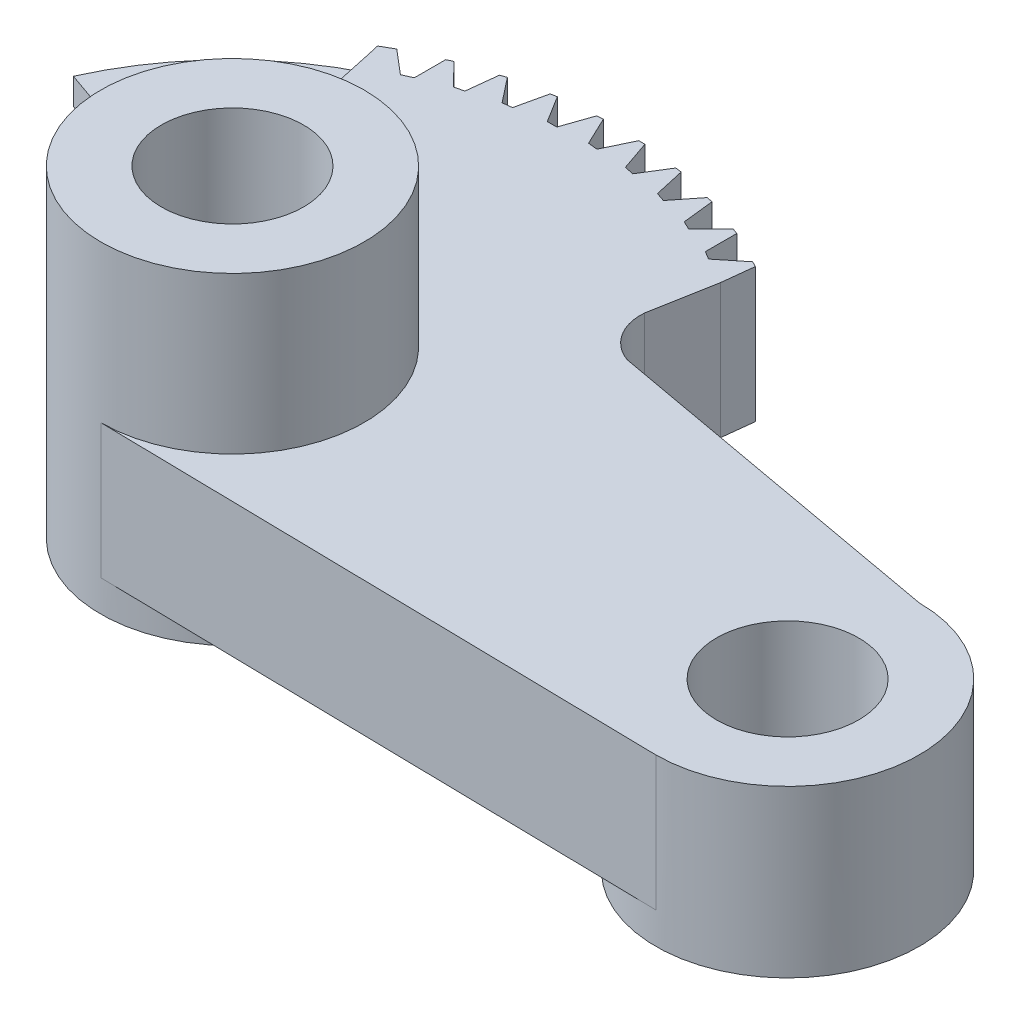
from build123d import *

# Parameters (mm, degrees)
SKETCH_1_R          = 2.7000000000000006
SKETCH_1_R_2        = 2.700000000000003
EXTRUDE_1_DEPTH     = 5.1
SKETCH_2_R          = 4.999999999999998
SKETCH_2_R_2        = 2.5
EXTRUDE_2_DEPTH     = 5.94
CUT_EXTRUDE_1_DEPTH = 3.5
CUT_EXTRUDE_START   = -0.6
CUT_EXTRUDE_3_DEPTH = 0.6
EXTRUDE_START       = 1.2
SKETCH_6_R          = 4.999999999999998
SKETCH_6_R_2        = 2.5
SKETCH_6_R_3        = 5
SKETCH_6_R_4        = 2.4999999999999987
EXTRUDE_4_DEPTH     = 1.2
SKETCH_7_R          = 2.6000000000000005
CUT_EXTRUDE_4_DEPTH = 33.57721194023454
SKETCH_8_R          = 2.6
CUT_EXTRUDE_5_DEPTH = 31.8406734329677
SKETCH_10_R         = 2.7
CUT_EXTRUDE_6_DEPTH = 33.57721194023454
SKETCH_11_R         = 2.700000000000001
CUT_EXTRUDE_7_DEPTH = 31.8406734329677


with BuildPart() as part:
    # Эскиз1 → Бобышка-Вытянуть1 (new body)
    with BuildSketch(Plane(origin=(0, 0, 0), x_dir=(1, 0, 0), z_dir=(0, 1, 0))):
        with BuildLine():
            Line((6.718023264525762, 8.928267668376021), (7.161238337218641, 11.37785065819786))
            Line((7.161238337218641, 11.37785065819786), (7.294846288705666, 12.560700282216452))
            Line((7.294846288705666, 12.560700282216452), (7.085001061393901, 12.665407082864023))
            Line((7.085001061393901, 12.665407082864023), (6.15987792536569, 11.916319971156167))
            Line((6.15987792536569, 11.916319971156167), (5.853623131200735, 12.10383694173367))
            Line((5.853623131200735, 12.10383694173367), (5.855060736117009, 13.29420757772634))
            Line((5.855060736117009, 13.29420757772634), (5.634886528714601, 13.37496556136943))
            Line((5.634886528714601, 13.37496556136943), (4.798663389284832, 12.527784837542624))
            Line((4.798663389284832, 12.527784837542624), (4.473480547373511, 12.680135526842204))
            Line((4.473480547373511, 12.680135526842204), (4.342730025112913, 13.863304415323501))
            Line((4.342730025112913, 13.863304415323501), (4.114949999467502, 13.919114749889351))
            Line((4.114949999467502, 13.919114749889351), (3.3779694438823102, 12.984318526945106))
            Line((3.3779694438823102, 12.984318526945106), (3.0378804853992434, 13.099618628946285))
            Line((3.0378804853992434, 13.099618628946285), (2.776558986480811, 14.260952083189514))
            Line((2.776558986480811, 14.260952083189514), (2.54399037483231, 14.291124494483034))
            Line((2.54399037483231, 14.291124494483034), (1.9153675367628848, 13.280274532718662))
            Line((1.9153675367628848, 13.280274532718662), (1.56457875493138, 13.35709799101592))
            Line((1.56457875493138, 13.35709799101592), (1.175918359734634, 14.482232389631033))
            Line((1.175918359734634, 14.482232389631033), (0.9414376205823001, 14.486393698794194))
            Line((0.9414376205823001, 14.486393698794194), (0.4289474421954887, 13.411992407470256))
            Line((0.42894744219548875, 13.411992407470256), (0.07179746795026506, 13.449389053044667))
            Line((0.07179746795026506, 13.449389053044667), (-0.4393947883485354, 14.524408492330128))
            Line((-0.43939478834853546, 14.524408492330128), (-0.6728875469021285, 14.502507231398162))
            Line((-0.6728875469021285, 14.502507231398162), (-1.062906477097084, 13.377843036257644))
            Line((-1.062906477097084, 13.377843036257644), (-1.4220003362283888, 13.375350339371238))
            Line((-1.4220003362283888, 13.375350339371238), (-2.049401918098927, 14.386958748197415))
            Line((-2.049401918098927, 14.386958748197415), (-2.279018807507275, 14.33926579666565))
            Line((-2.279018807507275, 14.33926579666565), (-2.5417426516817105, 13.178248785832608))
            Line((-2.5417426516817105, 13.178248785832608), (-2.898339045786024, 13.13589757669542))
            Line((-2.898339045786024, 13.13589757669542), (-3.6341901158202092, 14.071583165165732))
            Line((-3.6341901158202092, 14.071583165165732), (-3.8570911851181764, 13.998688399693854))
            Line((-3.8570911851181764, 13.998688399693854), (-3.989270518385492, 12.815678280718325))
            Line((-3.989270518385492, 12.815678280718325), (-4.3389589867331635, 12.733992368173748))
            Line((-4.3389589867331635, 12.733992368173748), (-5.174158380979493, 13.582182376127184))
            Line((-5.174158380979493, 13.582182376127184), (-5.3875867419063175, 13.48498737481814))
            Line((-5.3875867419063175, 13.48498737481814), (-5.3875867419063175, 12.2946158707315))
            Line((-5.3875867419063175, 12.2946158707315), (-5.751610974482103, 12.12883970299033))
            Line((-5.751610974482103, 12.12883970299033), (-6.666748566138722, 12.905854249247858))
            Line((-6.666748566138722, 12.905854249247858), (-7.13096440438616, 12.63943472468846))
            Line((-7.13096440438616, 12.63943472468846), (-7.025830916712447, 12.175864106991055))
            ThreePointArc((-7.025830916712449, 12.175864106991055), (-10.264322646127633, 9.799709596012173), (-12.51111253150909, 6.470163958468902))
            Line((-12.51111253150909, 6.470163958468902), (-5.241071220187256, 3.924995297345621))
            Line((-5.241071220187256, 3.924995297345621), (-4.737733567637334, 1.5980865565051285))
            ThreePointArc((-4.737733567637334, 1.5980865565051288), (-4.061430338102922, -2.9162962141622684), (1.55e-15, -5))
            Line((2.2e-16, -5), (21.46693589645179, -5.388260461869603))
            ThreePointArc((21.46693589645179, -5.388260461869605), (26.46693589645179, -0.3882604618696045), (21.46693589645179, 4.611739538130397))
            Line((21.46693589645179, 4.611739538130397), (7.924308406385933, 7.062073595968816))
            ThreePointArc((7.924308406385932, 7.062073595968816), (7.00463576208043, 7.790569444059032), (6.718023264525762, 8.928267668376021))
        make_face()
        with Locations(Location((21.46693589645179, -0.3882604618696027, 0), (0, 0, 270))):
            Circle(SKETCH_1_R, mode=Mode.SUBTRACT)
        with Locations(Location((-2.22e-15, -1.39e-15, 0), (0, 0, 270))):
            Circle(SKETCH_1_R_2, mode=Mode.SUBTRACT)
    extrude(amount=EXTRUDE_1_DEPTH)

    # Эскиз2 → Бобышка-Вытянуть2 (add)
    with BuildSketch(Plane(origin=(0, 5.1, 0), x_dir=(1, 0, 0), z_dir=(0, 1, 0))):
        with Locations(Location((0, 0, 0), (0, 0, 270))):
            Circle(SKETCH_2_R)
        with Locations(Location((0, 0, 0), (0, 0, 270))):
            Circle(SKETCH_2_R_2, mode=Mode.SUBTRACT)
    extrude(amount=EXTRUDE_2_DEPTH)

    # Эскиз4 → Вырез-Вытянуть1 (cut)
    with BuildSketch(Plane.XZ):
        with BuildLine():
            Line((-5.241071220187255, -3.924995297345621), (-7.025830916712447, -12.175864106991055))
            ThreePointArc((-7.025830916712447, -12.175864106991055), (-10.264322646127628, -9.799709596012166), (-12.511112531509088, -6.470163958468901))
            Line((-12.511112531509088, -6.470163958468901), (-5.241071220187255, -3.924995297345621))
        make_face()
    extrude(amount=-CUT_EXTRUDE_1_DEPTH, mode=Mode.SUBTRACT)

    # Эскиз5 → Вырез-Вытянуть3 (cut)
    with BuildSketch(Plane(origin=(0, 5.1, 0), x_dir=(1, 0, 0), z_dir=(0, 1, 0)).offset(CUT_EXTRUDE_START)):
        with BuildLine():
            Line((-5.241071220187255, 3.924995297345621), (-7.025830916712447, 12.175864106991055))
            ThreePointArc((-7.025830916712447, 12.175864106991055), (-10.264322646127628, 9.799709596012168), (-12.511112531509088, 6.470163958468901))
            Line((-12.511112531509088, 6.470163958468901), (-5.241071220187255, 3.924995297345621))
        make_face()
    extrude(amount=CUT_EXTRUDE_3_DEPTH, mode=Mode.SUBTRACT)

    # Эскиз6 → Бобышка-Вытянуть4 (add)
    # profile 1 of 2: a face of its own
    with BuildSketch(Plane.XZ.offset(EXTRUDE_START)):
        with Locations(Location((0, 0, 0), (0, 0, 270))):
            Circle(SKETCH_6_R)
        with Locations(Location((0, 0, 0), (0, 0, 90))):
            Circle(SKETCH_6_R_2, mode=Mode.SUBTRACT)
    # profile 2 of 2: a face of its own
    with BuildSketch(Plane.XZ.offset(EXTRUDE_START)):
        with Locations(Location((21.46693589645179, 0.38826046186960295, 0), (0, 0, 270))):
            Circle(SKETCH_6_R_3)
        with Locations(Location((21.46693589645179, 0.38826046186960295, 0), (0, 0, 270))):
            Circle(SKETCH_6_R_4, mode=Mode.SUBTRACT)
    extrude(amount=-EXTRUDE_4_DEPTH)

    # Эскиз7 → Вырез-Вытянуть4 (cut, through all)
    with BuildSketch(Plane(origin=(0, 11.04, 0), x_dir=(1, 0, 0), z_dir=(0, 1, 0))):
        with Locations(Location((0, 0, 0), (0, 0, 270))):
            Circle(SKETCH_7_R)
    extrude(amount=-CUT_EXTRUDE_4_DEPTH, mode=Mode.SUBTRACT)

    # Эскиз8 → Вырез-Вытянуть5 (cut, through all)
    with BuildSketch(Plane(origin=(0, 5.1, 0), x_dir=(1, 0, 0), z_dir=(0, 1, 0))):
        with Locations(Location((21.46693589645179, -0.38826046186960295, 0), (0, 0, 270))):
            Circle(SKETCH_8_R)
    extrude(amount=-CUT_EXTRUDE_5_DEPTH, mode=Mode.SUBTRACT)

    # Эскиз10 → Вырез-Вытянуть6 (cut, through all)
    with BuildSketch(Plane(origin=(0, 11.04, 0), x_dir=(1, 0, 0), z_dir=(0, 1, 0))):
        with Locations(Location((0, 0, 0), (0, 0, 270))):
            Circle(SKETCH_10_R)
    extrude(amount=-CUT_EXTRUDE_6_DEPTH, mode=Mode.SUBTRACT)

    # Эскиз11 → Вырез-Вытянуть7 (cut, through all)
    with BuildSketch(Plane(origin=(0, 5.1, 0), x_dir=(1, 0, 0), z_dir=(0, 1, 0))):
        with Locations(Location((21.46693589645179, -0.38826046186960295, 0), (0, 0, 270))):
            Circle(SKETCH_11_R)
    extrude(amount=-CUT_EXTRUDE_7_DEPTH, mode=Mode.SUBTRACT)


solid = part.part
